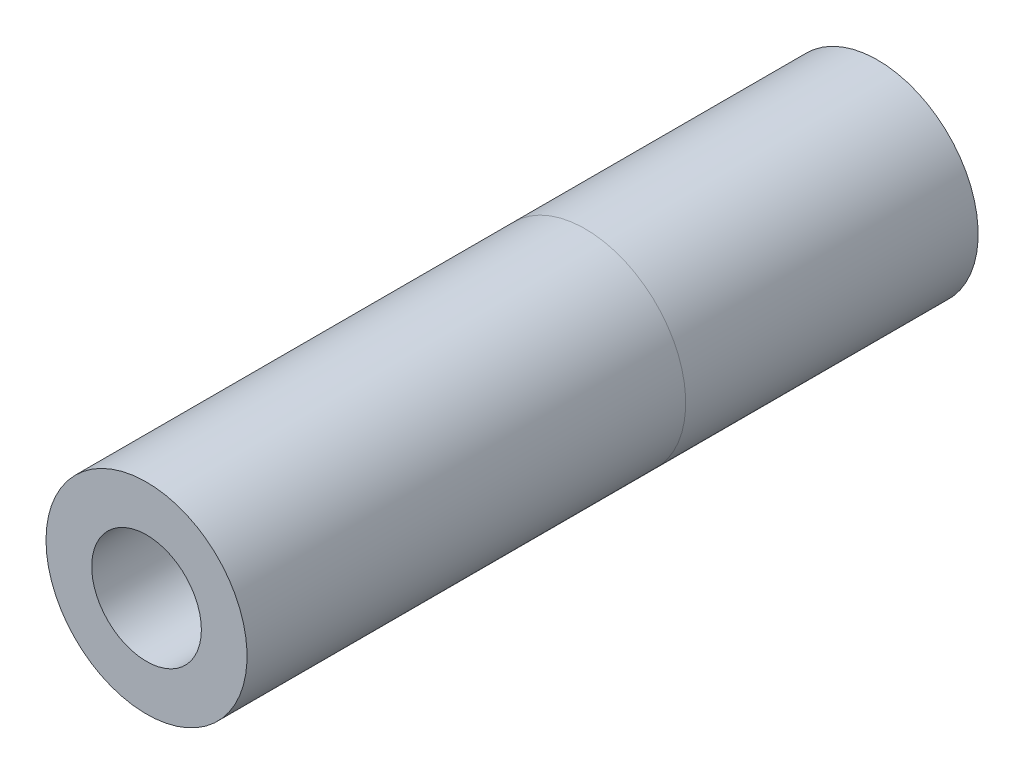
from build123d import *

# Parameters (mm, degrees)
SWEEP1_PROFILE_R     = 8.73125
CUT_SWEEP1_PROFILE_R = 4.7625


with BuildPart() as part:
    # Sweep1: sweep along a curve in space
    with BuildLine() as sweep1_path:
        Line((0, 0, 0), (0, 0, 25.4))
        Line((0, 0, 25.4), (0, 0, 63.5))
    # Sweep1 profile (on start of the path) → Sweep1 (sweep)
    with BuildSketch(Plane.XY):
        Circle(SWEEP1_PROFILE_R)
    sweep(path=sweep1_path.line)

    # Cut-Sweep1: sweep along a curve in space
    with BuildLine() as cut_sweep1_path:
        Line((0, 0, 0), (0, 0, 25.4))
        Line((0, 0, 25.4), (0, 0, 63.5))
    # Cut-Sweep1 profile (on start of the path) → Cut-Sweep1 (sweep, cut)
    with BuildSketch(Plane.XY):
        Circle(CUT_SWEEP1_PROFILE_R)
    sweep(path=cut_sweep1_path.line, mode=Mode.SUBTRACT)


solid = part.part
